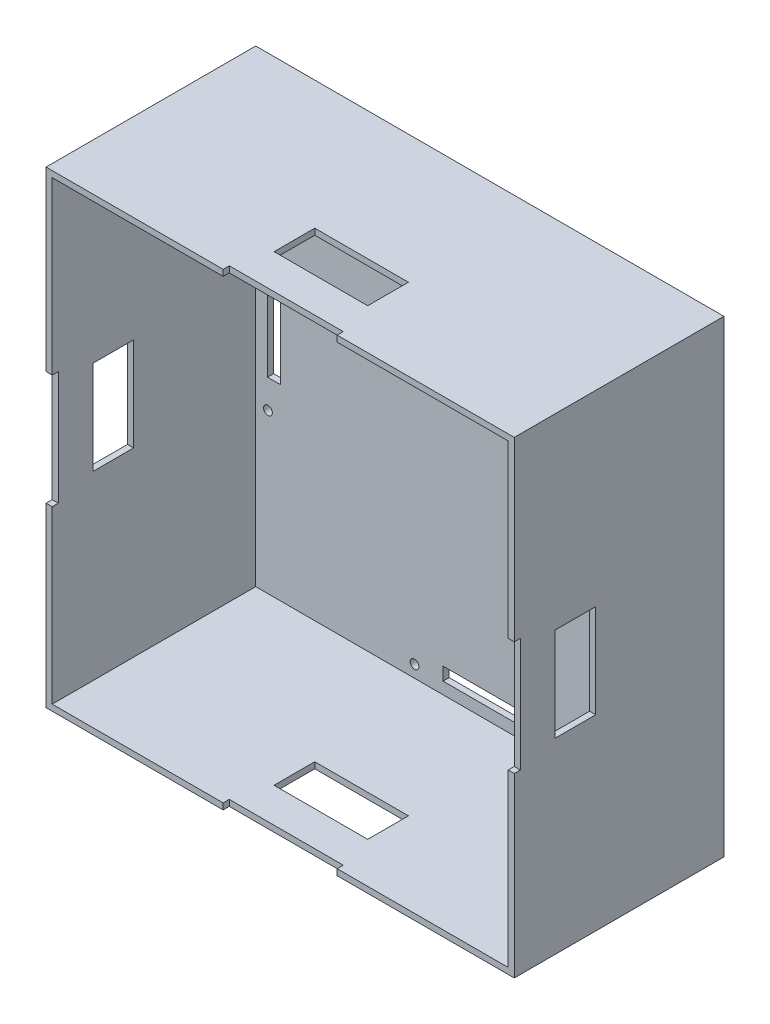
from build123d import *

# Parameters (mm, degrees)
SKETCH_1_W               = 230
SKETCH_1_H               = 230
EXTRUDE_1_DEPTH          = 3
SKETCH_3_W               = 230
SKETCH_3_H               = 230
EXTRUDE_3_DEPTH          = 100
SKETCH_4_W               = 220
SKETCH_4_H               = 220
CUT_EXTRUDE_1_DEPTH      = 100
SKETCH_6_W               = 20
SKETCH_6_H               = 46
CUT_EXTRUDE_3_DEPTH      = 278.009025124
PATTERN_CIRCULAR_1_COUNT = 2
PATTERN_CIRCULAR_1_ANGLE = 90
SKETCH_11_W              = 224
SKETCH_11_H              = 224
CUT_EXTRUDE_5_DEPTH      = 100
SKETCH_13_W              = 3
SKETCH_13_H              = 56
CUT_EXTRUDE_7_DEPTH      = 278.009025124
SKETCH_14_R              = 2.15
SKETCH_14_W              = 6.4
SKETCH_14_H              = 40
SKETCH_14_W_2            = 40
SKETCH_14_H_2            = 6.4
CUT_EXTRUDE_8_DEPTH      = 191.91883092
PATTERN_CIRCULAR_2_COUNT = 2
PATTERN_CIRCULAR_2_ANGLE = 90


with BuildPart() as part:
    # 스케치1 → 보스-돌출1 (new body)
    with BuildSketch(Plane.XY):
        Rectangle(SKETCH_1_W, SKETCH_1_H)
    extrude(amount=EXTRUDE_1_DEPTH)

    # 스케치3 → 보스-돌출3 (add)
    with BuildSketch(Plane.XY.offset(3)):
        Rectangle(SKETCH_3_W, SKETCH_3_H)
    extrude(amount=EXTRUDE_3_DEPTH)

    # 스케치4 → 컷-돌출1 (cut)
    with BuildSketch(Plane.XY.offset(103)):
        Rectangle(SKETCH_4_W, SKETCH_4_H)
    extrude(amount=-CUT_EXTRUDE_1_DEPTH, mode=Mode.SUBTRACT)

    # 스케치6 → 컷-돌출3 (cut, through all)
    with BuildSketch(Plane.ZY.offset(115)):
        with Locations((73, 0)):
            Rectangle(SKETCH_6_W, SKETCH_6_H)
    cut_extrude_3 = extrude(amount=-CUT_EXTRUDE_3_DEPTH, mode=Mode.SUBTRACT)

    # 원형 패턴1: 컷-돌출3 ×2 about axis
    pattern_circular_1_axis = Axis((0, 0, 0), (0, 0, 1))
    for i in range(1, PATTERN_CIRCULAR_1_COUNT):
        add(cut_extrude_3.rotate(pattern_circular_1_axis, i * PATTERN_CIRCULAR_1_ANGLE / (PATTERN_CIRCULAR_1_COUNT - 1)), mode=Mode.SUBTRACT)

    # 스케치11 → 컷-돌출5 (cut)
    with BuildSketch(Plane.XY.offset(103)):
        Rectangle(SKETCH_11_W, SKETCH_11_H)
    extrude(amount=-CUT_EXTRUDE_5_DEPTH, mode=Mode.SUBTRACT)

    # 스케치13 → 컷-돌출7 (cut, through all)
    with BuildSketch(Plane.ZY.offset(115)):
        with Locations((101.5, 0)):
            Rectangle(SKETCH_13_W, SKETCH_13_H)
    cut_extrude_7 = extrude(amount=-CUT_EXTRUDE_7_DEPTH, mode=Mode.SUBTRACT)

    # 스케치14 → 컷-돌출8 (cut, through all)
    with BuildSketch(Plane.XY.offset(3)):
        with Locations((-106, -34)):
            Circle(SKETCH_14_R)
        with Locations((-106, 34)):
            Circle(SKETCH_14_R)
        with Locations((-34, 106)):
            Circle(SKETCH_14_R)
        with Locations((34, 106)):
            Circle(SKETCH_14_R)
        with Locations((106, 34)):
            Circle(SKETCH_14_R)
        with Locations((106, -34)):
            Circle(SKETCH_14_R)
        with Locations((34, -106)):
            Circle(SKETCH_14_R)
        with Locations((-34, -106)):
            Circle(SKETCH_14_R)
        with Locations((-103, 0)):
            Rectangle(SKETCH_14_W, SKETCH_14_H)
        with Locations((0, 103)):
            Rectangle(SKETCH_14_W_2, SKETCH_14_H_2)
        with Locations((103, 0)):
            Rectangle(SKETCH_14_W, SKETCH_14_H)
        with Locations((0, -103)):
            Rectangle(SKETCH_14_W_2, SKETCH_14_H_2)
    extrude(amount=-CUT_EXTRUDE_8_DEPTH, mode=Mode.SUBTRACT)

    # 원형 패턴2: 컷-돌출7 ×2 about axis
    pattern_circular_2_axis = Axis((0, 0, -18.105724747), (0, 0, 1))
    for i in range(1, PATTERN_CIRCULAR_2_COUNT):
        add(cut_extrude_7.rotate(pattern_circular_2_axis, i * PATTERN_CIRCULAR_2_ANGLE / (PATTERN_CIRCULAR_2_COUNT - 1)), mode=Mode.SUBTRACT)


solid = part.part
